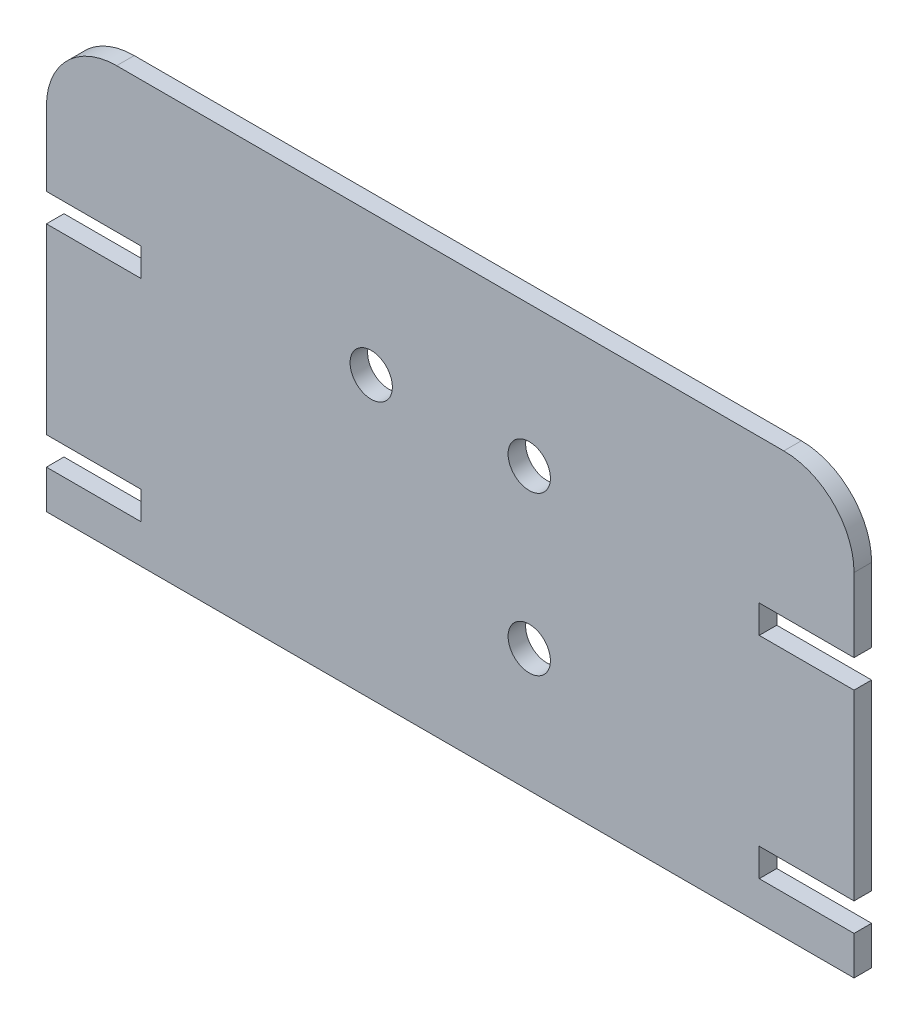
from build123d import *

# Parameters (mm, degrees)
SKETCH1_W           = 230
SKETCH1_H           = 120
BOSS_EXTRUDE1_DEPTH = 5
CUT_EXTRUDE1_REACH  = 131.808
SKETCH2_W           = 27
SKETCH2_H           = 8.000000001
CUT_EXTRUDE2_REACH  = 131.808
SKETCH3_R           = 6.025
FILLET1_R           = 20


with BuildPart() as part:
    # Sketch1 → Boss-Extrude1 (new body)
    with BuildSketch(Plane.XY):
        Rectangle(SKETCH1_W, SKETCH1_H)
    extrude(amount=BOSS_EXTRUDE1_DEPTH)

    # Sketch2 → Cut-Extrude1 (cut, up to next)
    with BuildSketch(Plane(origin=(0, 0, 0), x_dir=(-1, 0, 0), z_dir=(0, 0, -1)), mode=Mode.PRIVATE) as cut_extrude1_sk1:
        with Locations((101.5, 15.000000001)):
            Rectangle(SKETCH2_W, SKETCH2_H)
    cut_extrude1_tool1 = extrude(cut_extrude1_sk1.sketch, amount=-CUT_EXTRUDE1_REACH, mode=Mode.PRIVATE) & part.part
    # Sketch2 → Cut-Extrude1 (cut, up to next)
    with BuildSketch(Plane(origin=(0, 0, 0), x_dir=(-1, 0, 0), z_dir=(0, 0, -1)), mode=Mode.PRIVATE) as cut_extrude1_sk2:
        with Locations((101.5, -45.000000001)):
            Rectangle(SKETCH2_W, SKETCH2_H)
    cut_extrude1_tool2 = extrude(cut_extrude1_sk2.sketch, amount=-CUT_EXTRUDE1_REACH, mode=Mode.PRIVATE) & part.part
    # Sketch2 → Cut-Extrude1 (cut, up to next)
    with BuildSketch(Plane(origin=(0, 0, 0), x_dir=(-1, 0, 0), z_dir=(0, 0, -1)), mode=Mode.PRIVATE) as cut_extrude1_sk3:
        with Locations((-101.5, -45.000000001)):
            Rectangle(SKETCH2_W, SKETCH2_H)
    cut_extrude1_tool3 = extrude(cut_extrude1_sk3.sketch, amount=-CUT_EXTRUDE1_REACH, mode=Mode.PRIVATE) & part.part
    # Sketch2 → Cut-Extrude1 (cut, up to next)
    with BuildSketch(Plane(origin=(0, 0, 0), x_dir=(-1, 0, 0), z_dir=(0, 0, -1)), mode=Mode.PRIVATE) as cut_extrude1_sk4:
        with Locations((-101.5, 15.000000001)):
            Rectangle(SKETCH2_W, SKETCH2_H)
    cut_extrude1_tool4 = extrude(cut_extrude1_sk4.sketch, amount=-CUT_EXTRUDE1_REACH, mode=Mode.PRIVATE) & part.part
    add(cut_extrude1_tool1.solids().sort_by_distance((-101.5, 15, 0))[0], mode=Mode.SUBTRACT)
    add(cut_extrude1_tool2.solids().sort_by_distance((-101.5, -45, 0))[0], mode=Mode.SUBTRACT)
    add(cut_extrude1_tool3.solids().sort_by_distance((101.5, -45, 0))[0], mode=Mode.SUBTRACT)
    add(cut_extrude1_tool4.solids().sort_by_distance((101.5, 15, 0))[0], mode=Mode.SUBTRACT)

    # Sketch3 → Cut-Extrude2 (cut, up to next)
    with BuildSketch(Plane.XY.offset(5), mode=Mode.PRIVATE) as cut_extrude2_sk1:
        with Locations((22.5, 20)):
            Circle(SKETCH3_R)
    cut_extrude2_tool1 = extrude(cut_extrude2_sk1.sketch, amount=-CUT_EXTRUDE2_REACH, mode=Mode.PRIVATE) & part.part
    # Sketch3 → Cut-Extrude2 (cut, up to next)
    with BuildSketch(Plane.XY.offset(5), mode=Mode.PRIVATE) as cut_extrude2_sk2:
        with Locations((-22.5, 20)):
            Circle(SKETCH3_R)
    cut_extrude2_tool2 = extrude(cut_extrude2_sk2.sketch, amount=-CUT_EXTRUDE2_REACH, mode=Mode.PRIVATE) & part.part
    # Sketch3 → Cut-Extrude2 (cut, up to next)
    with BuildSketch(Plane.XY.offset(5), mode=Mode.PRIVATE) as cut_extrude2_sk3:
        with Locations((22.5, -25)):
            Circle(SKETCH3_R)
    cut_extrude2_tool3 = extrude(cut_extrude2_sk3.sketch, amount=-CUT_EXTRUDE2_REACH, mode=Mode.PRIVATE) & part.part
    add(cut_extrude2_tool1.solids().sort_by_distance((22.5, 20, 5))[0], mode=Mode.SUBTRACT)
    add(cut_extrude2_tool2.solids().sort_by_distance((-22.5, 20, 5))[0], mode=Mode.SUBTRACT)
    add(cut_extrude2_tool3.solids().sort_by_distance((22.5, -25, 5))[0], mode=Mode.SUBTRACT)

    # Fillet1
    fillet1_edges = [part.edges().sort_by_distance(p)[0] for p in [
        (-115, 60, 2.5),
        (115, 60, 2.5),
    ]]
    fillet(fillet1_edges, radius=FILLET1_R)


solid = part.part
